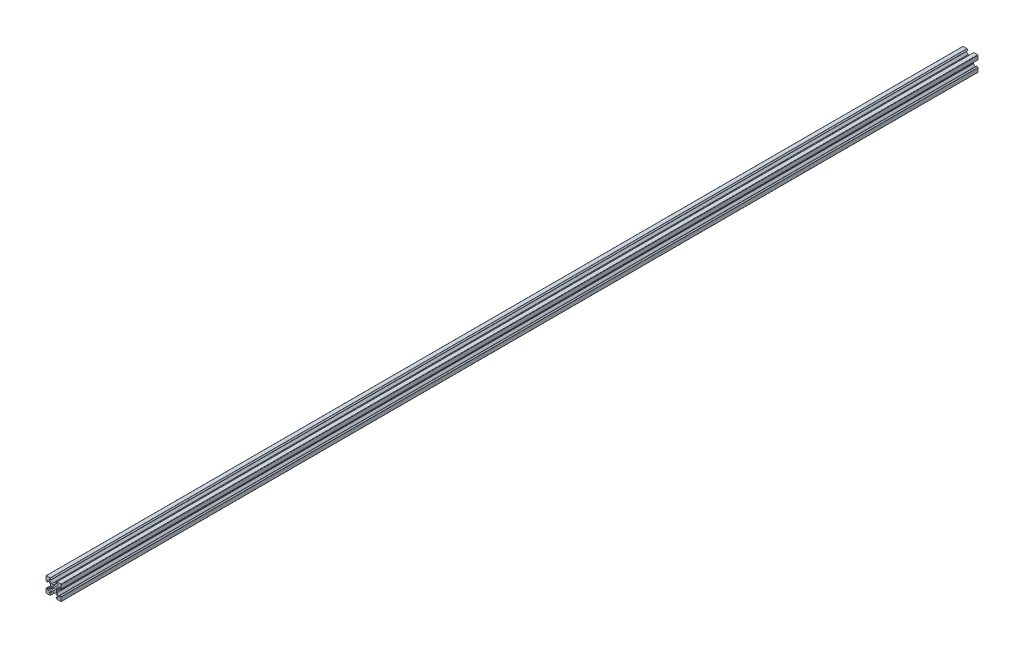
from build123d import *

# Parameters (mm, degrees)
BOSS_EXTRUDE1_DEPTH = 1205


with BuildPart() as part:
    # Model → Boss-Extrude1 (new body)
    with BuildSketch(Plane.XY):
        with BuildLine():
            Line((2013.231211125, 1378.500393717), (2014.131175411, 1378.500393717))
            ThreePointArc((2014.131175411, 1378.500393717), (2014.245980441, 1378.523229857), (2014.343307446, 1378.588261683))
            Line((2014.343307446, 1378.588261683), (2014.688390533, 1378.93334477))
            ThreePointArc((2014.688390533, 1378.93334477), (2014.933942847, 1379.019345399), (2015.154358637, 1378.881110358))
            ThreePointArc((2015.154358637, 1378.881110358), (2019.031211125, 1380.000393717), (2015.154358637, 1381.119677076))
            ThreePointArc((2015.154358637, 1381.119677076), (2014.933942847, 1380.981442035), (2014.688390533, 1381.067442664))
            Line((2014.688390533, 1381.067442664), (2014.343307446, 1381.412525751))
            ThreePointArc((2014.343307446, 1381.412525751), (2014.245980441, 1381.477557577), (2014.131175412, 1381.500393717))
            Line((2014.131175412, 1381.500393717), (2013.231211125, 1381.500393717))
            ThreePointArc((2013.231211125, 1381.500393717), (2013.01907909, 1381.588261683), (2012.931211125, 1381.800393717))
            Line((2012.931211125, 1381.800393717), (2012.931211125, 1382.700358004))
            ThreePointArc((2012.931211125, 1382.700358004), (2012.908374985, 1382.815163033), (2012.843343159, 1382.912490038))
            Line((2012.843343159, 1382.912490038), (2010.378662785, 1385.377170412))
            ThreePointArc((2010.378662785, 1385.377170412), (2010.297556948, 1385.4313636), (2010.20188609, 1385.450393717))
            Line((2010.20188609, 1385.450393717), (2008.881211125, 1385.450393717))
            ThreePointArc((2008.881211125, 1385.450393717), (2008.70443443, 1385.377170412), (2008.631211125, 1385.200393717))
            Line((2008.631211125, 1385.200393717), (2008.631211125, 1383.350393717))
            ThreePointArc((2008.631211125, 1383.350393717), (2008.476881983, 1383.119423834), (2008.20443443, 1383.173617022))
            Line((2008.20443443, 1383.173617022), (2007.01907909, 1384.358972361))
            ThreePointArc((2007.01907909, 1384.358972361), (2006.954047265, 1384.456299366), (2006.931211125, 1384.571104395))
            Line((2006.931211125, 1384.571104395), (2006.931211125, 1389.500393717))
            ThreePointArc((2006.931211125, 1389.500393717), (2007.077657734, 1389.853947108), (2007.431211125, 1390.000393717))
            Line((2007.431211125, 1390.000393717), (2012.360500447, 1390.000393717))
            ThreePointArc((2012.360500447, 1390.000393717), (2012.475305476, 1389.977557577), (2012.572632481, 1389.912525752))
            Line((2012.572632481, 1389.912525752), (2013.75798782, 1388.727170412))
            ThreePointArc((2013.75798782, 1388.727170412), (2013.812181008, 1388.454722859), (2013.581211125, 1388.300393717))
            Line((2013.581211125, 1388.300393717), (2011.731211125, 1388.300393717))
            ThreePointArc((2011.731211125, 1388.300393717), (2011.55443443, 1388.227170412), (2011.481211125, 1388.050393717))
            Line((2011.481211125, 1388.050393717), (2011.481211125, 1386.729718752))
            ThreePointArc((2011.481211125, 1386.729718752), (2011.500241242, 1386.634047894), (2011.55443443, 1386.552942057))
            Line((2011.55443443, 1386.552942057), (2014.033759465, 1384.073617022))
            ThreePointArc((2014.033759465, 1384.073617022), (2014.114865302, 1384.019423834), (2014.21053616, 1384.000393717))
            Line((2014.21053616, 1384.000393717), (2016.470233902, 1384.000393717))
            ThreePointArc((2016.470233902, 1384.000393717), (2016.61325329, 1383.964108439), (2016.721676023, 1383.864030081))
            ThreePointArc((2016.721676023, 1383.864030081), (2016.931211125, 1383.750393717), (2017.140746226, 1383.864030081))
            ThreePointArc((2017.140746226, 1383.864030081), (2017.24916896, 1383.964108439), (2017.392188348, 1384.000393717))
            Line((2017.392188348, 1384.000393717), (2019.65188609, 1384.000393717))
            ThreePointArc((2019.65188609, 1384.000393717), (2019.747556948, 1384.019423834), (2019.828662785, 1384.073617022))
            Line((2019.828662785, 1384.073617022), (2022.30798782, 1386.552942057))
            ThreePointArc((2022.30798782, 1386.552942057), (2022.362181008, 1386.634047894), (2022.381211125, 1386.729718752))
            Line((2022.381211125, 1386.729718752), (2022.381211125, 1388.050393717))
            ThreePointArc((2022.381211125, 1388.050393717), (2022.30798782, 1388.227170412), (2022.131211125, 1388.300393717))
            Line((2022.131211125, 1388.300393717), (2020.281211125, 1388.300393717))
            ThreePointArc((2020.281211125, 1388.300393717), (2020.050241242, 1388.454722859), (2020.10443443, 1388.727170412))
            Line((2020.10443443, 1388.727170412), (2021.289789769, 1389.912525752))
            ThreePointArc((2021.289789769, 1389.912525752), (2021.387116773, 1389.977557577), (2021.501921803, 1390.000393717))
            Line((2021.501921803, 1390.000393717), (2026.431211125, 1390.000393717))
            ThreePointArc((2026.431211125, 1390.000393717), (2026.784764515, 1389.853947108), (2026.931211125, 1389.500393717))
            Line((2026.931211125, 1389.500393717), (2026.931211125, 1384.571104395))
            ThreePointArc((2026.931211125, 1384.571104395), (2026.908374985, 1384.456299366), (2026.843343159, 1384.358972361))
            Line((2026.843343159, 1384.358972361), (2025.65798782, 1383.173617022))
            ThreePointArc((2025.65798782, 1383.173617022), (2025.385540267, 1383.119423834), (2025.231211125, 1383.350393717))
            Line((2025.231211125, 1383.350393717), (2025.231211125, 1385.200393717))
            ThreePointArc((2025.231211125, 1385.200393717), (2025.15798782, 1385.377170412), (2024.981211125, 1385.450393717))
            Line((2024.981211125, 1385.450393717), (2023.66053616, 1385.450393717))
            ThreePointArc((2023.66053616, 1385.450393717), (2023.564865302, 1385.4313636), (2023.483759465, 1385.377170412))
            Line((2023.483759465, 1385.377170412), (2021.00443443, 1382.897845377))
            ThreePointArc((2021.00443443, 1382.897845377), (2020.950241242, 1382.81673954), (2020.931211125, 1382.721068682))
            Line((2020.931211125, 1382.721068682), (2020.931211125, 1380.46137094))
            ThreePointArc((2020.931211125, 1380.46137094), (2020.894925847, 1380.318351552), (2020.794847489, 1380.209928818))
            ThreePointArc((2020.794847489, 1380.209928818), (2020.681211125, 1380.000393717), (2020.794847488, 1379.790858616))
            ThreePointArc((2020.794847488, 1379.790858616), (2020.894925847, 1379.682435882), (2020.931211125, 1379.539416494))
            Line((2020.931211125, 1379.539416494), (2020.931211125, 1377.279718752))
            ThreePointArc((2020.931211125, 1377.279718752), (2020.950241242, 1377.184047894), (2021.00443443, 1377.102942057))
            Line((2021.00443443, 1377.102942057), (2023.483759465, 1374.623617022))
            ThreePointArc((2023.483759465, 1374.623617022), (2023.564865302, 1374.569423834), (2023.66053616, 1374.550393717))
            Line((2023.66053616, 1374.550393717), (2024.981211125, 1374.550393717))
            ThreePointArc((2024.981211125, 1374.550393717), (2025.15798782, 1374.623617022), (2025.231211125, 1374.800393717))
            Line((2025.231211125, 1374.800393717), (2025.231211125, 1376.650393717))
            ThreePointArc((2025.231211125, 1376.650393717), (2025.385540267, 1376.8813636), (2025.65798782, 1376.827170412))
            Line((2025.65798782, 1376.827170412), (2026.843343159, 1375.641815073))
            ThreePointArc((2026.843343159, 1375.641815073), (2026.908374985, 1375.544488069), (2026.931211125, 1375.429683039))
            Line((2026.931211125, 1375.429683039), (2026.931211125, 1370.500393717))
            ThreePointArc((2026.931211125, 1370.500393717), (2026.784764515, 1370.146840327), (2026.431211125, 1370.000393717))
            Line((2026.431211125, 1370.000393717), (2021.501921803, 1370.000393717))
            ThreePointArc((2021.501921803, 1370.000393717), (2021.387116773, 1370.023229857), (2021.289789769, 1370.088261683))
            Line((2021.289789769, 1370.088261683), (2020.10443443, 1371.273617022))
            ThreePointArc((2020.10443443, 1371.273617022), (2020.050241242, 1371.546064575), (2020.281211125, 1371.700393717))
            Line((2020.281211125, 1371.700393717), (2022.131211125, 1371.700393717))
            ThreePointArc((2022.131211125, 1371.700393717), (2022.30798782, 1371.773617022), (2022.381211125, 1371.950393717))
            Line((2022.381211125, 1371.950393717), (2022.381211125, 1373.271068682))
            ThreePointArc((2022.381211125, 1373.271068682), (2022.362181008, 1373.36673954), (2022.30798782, 1373.447845377))
            Line((2022.30798782, 1373.447845377), (2019.828662785, 1375.927170412))
            ThreePointArc((2019.828662785, 1375.927170412), (2019.747556948, 1375.9813636), (2019.65188609, 1376.000393717))
            Line((2019.65188609, 1376.000393717), (2017.392188348, 1376.000393717))
            ThreePointArc((2017.392188348, 1376.000393717), (2017.24916896, 1376.036678995), (2017.140746226, 1376.136757353))
            ThreePointArc((2017.140746226, 1376.136757353), (2016.931211125, 1376.250393717), (2016.721676023, 1376.136757354))
            ThreePointArc((2016.721676023, 1376.136757354), (2016.61325329, 1376.036678995), (2016.470233902, 1376.000393717))
            Line((2016.470233902, 1376.000393717), (2014.21053616, 1376.000393717))
            ThreePointArc((2014.21053616, 1376.000393717), (2014.114865302, 1375.9813636), (2014.033759465, 1375.927170412))
            Line((2014.033759465, 1375.927170412), (2011.55443443, 1373.447845377))
            ThreePointArc((2011.55443443, 1373.447845377), (2011.500241242, 1373.36673954), (2011.481211125, 1373.271068682))
            Line((2011.481211125, 1373.271068682), (2011.481211125, 1371.950393717))
            ThreePointArc((2011.481211125, 1371.950393717), (2011.55443443, 1371.773617022), (2011.731211125, 1371.700393717))
            Line((2011.731211125, 1371.700393717), (2013.581211125, 1371.700393717))
            ThreePointArc((2013.581211125, 1371.700393717), (2013.812181008, 1371.546064575), (2013.75798782, 1371.273617022))
            Line((2013.75798782, 1371.273617022), (2012.572632481, 1370.088261683))
            ThreePointArc((2012.572632481, 1370.088261683), (2012.475305476, 1370.023229857), (2012.360500447, 1370.000393717))
            Line((2012.360500447, 1370.000393717), (2007.431211125, 1370.000393717))
            ThreePointArc((2007.431211125, 1370.000393717), (2007.077657734, 1370.146840327), (2006.931211125, 1370.500393717))
            Line((2006.931211125, 1370.500393717), (2006.931211125, 1375.429683039))
            ThreePointArc((2006.931211125, 1375.429683039), (2006.954047265, 1375.544488069), (2007.01907909, 1375.641815073))
            Line((2007.01907909, 1375.641815073), (2008.20443443, 1376.827170412))
            ThreePointArc((2008.20443443, 1376.827170412), (2008.476881983, 1376.8813636), (2008.631211125, 1376.650393717))
            Line((2008.631211125, 1376.650393717), (2008.631211125, 1374.800393717))
            ThreePointArc((2008.631211125, 1374.800393717), (2008.70443443, 1374.623617022), (2008.881211125, 1374.550393717))
            Line((2008.881211125, 1374.550393717), (2010.20188609, 1374.550393717))
            ThreePointArc((2010.20188609, 1374.550393717), (2010.297556948, 1374.569423834), (2010.378662785, 1374.623617022))
            Line((2010.378662785, 1374.623617022), (2012.843343159, 1377.088297396))
            ThreePointArc((2012.843343159, 1377.088297396), (2012.908374985, 1377.185624401), (2012.931211125, 1377.300429431))
            Line((2012.931211125, 1377.300429431), (2012.931211125, 1378.200393717))
            ThreePointArc((2012.931211125, 1378.200393717), (2013.01907909, 1378.412525751), (2013.231211125, 1378.500393717))
        make_face()
    extrude(amount=BOSS_EXTRUDE1_DEPTH)


solid = part.part
